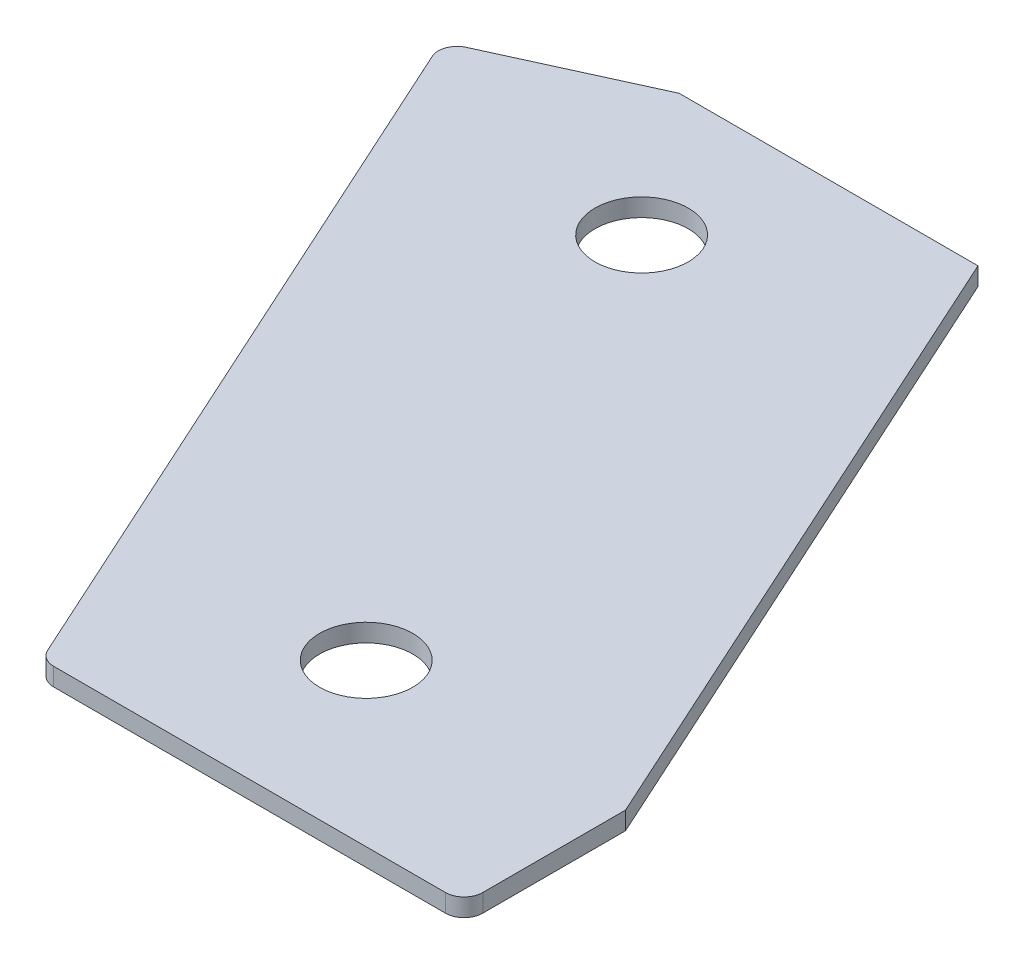
from build123d import *

# Parameters (mm, degrees)
BOSS_EXTRUDE1_DEPTH = 5
SKETCH2_R           = 13
CUT_EXTRUDE1_DEPTH  = 5


with BuildPart() as part:
    # Sketch1 → Boss-Extrude1 (new body)
    with BuildSketch(Plane(origin=(0, 0, 0), x_dir=(1, 0, 0), z_dir=(0, 1, 0))):
        with BuildLine():
            Line((67.945120995, -67.73797404), (67.945120995, -107.53797404))
            ThreePointArc((67.945120995, -107.53797404), (66.422076258, -111.214929302), (62.745120995, -112.73797404))
            Line((62.745120995, -112.73797404), (-46.431495334, -112.73797404))
            ThreePointArc((-46.431495334, -112.73797404), (-49.244562585, -111.911376907), (-51.163293943, -109.694378902))
            Line((-51.163293943, -109.694378902), (-140.925822463, 87.271513299))
            ThreePointArc((-140.925822463, 87.271513299), (-141.064719238, 91.248996543), (-138.350428716, 94.159716769))
            Line((-138.350428716, 94.159716769), (-97.584163781, 112.73797404))
            Line((-97.584163781, 112.73797404), (-14.302507037, 112.73797404))
            Line((-14.302507037, 112.73797404), (67.945120995, -67.73797404))
        make_face()
    extrude(amount=BOSS_EXTRUDE1_DEPTH)

    # Sketch2 → Cut-Extrude1 (cut)
    with BuildSketch(Plane(origin=(0, 5, 0), x_dir=(1, 0, 0), z_dir=(0, 1, 0))):
        with Locations(Location((-4.347057053, -67.73797404, 0), (0, 0, 270))):
            Circle(SKETCH2_R)
        with Locations(Location((-68.624509665, 73.306022946, 0), (0, 0, 270))):
            Circle(SKETCH2_R)
    extrude(amount=-CUT_EXTRUDE1_DEPTH, mode=Mode.SUBTRACT)


solid = part.part
